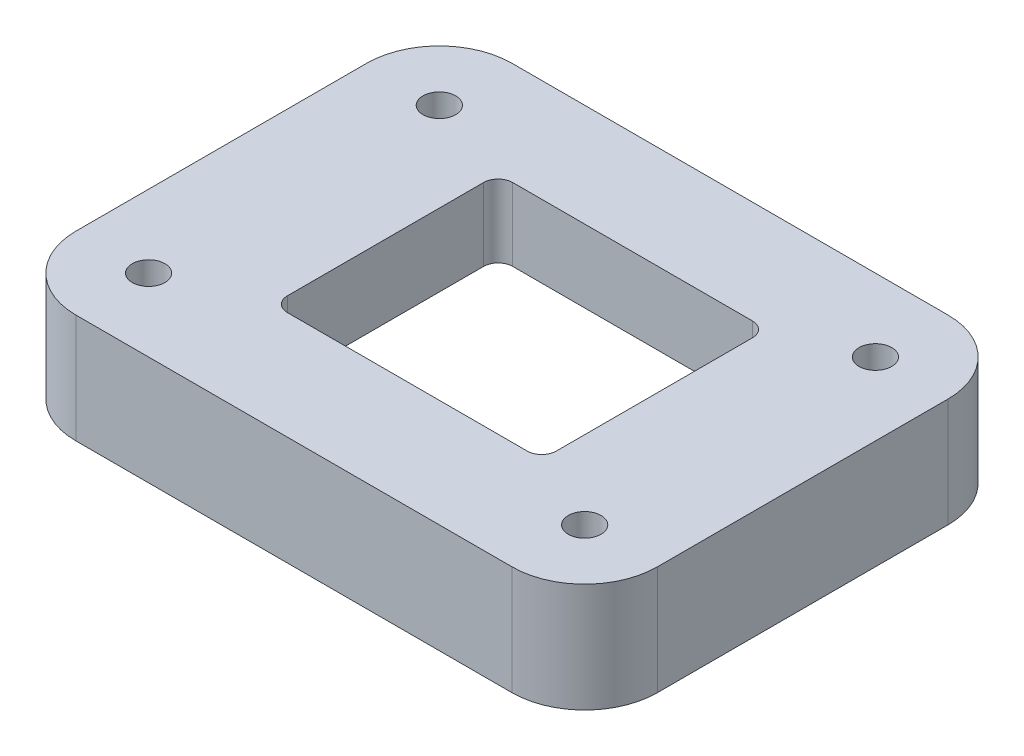
from build123d import *

# Parameters (mm, degrees)
ESQUISSE1_R             = 2.25
BOSS_EXTRU_1_DEPTH      = 15
ENL_V_MAT_EXTRU_1_DEPTH = 5


with BuildPart() as part:
    # Esquisse1 → Boss.-Extru.1 (new body)
    with BuildSketch(Plane(origin=(0, 0, 0), x_dir=(1, 0, 0), z_dir=(0, 1, 0))):
        with BuildLine():
            Line((10, 0), (70, 0))
            ThreePointArc((70, 0), (77.071067812, -2.928932188), (80, -10))
            Line((80, -10), (80, -50))
            ThreePointArc((80, -50), (77.071067812, -57.071067812), (70, -60))
            Line((70, -60), (10, -60))
            ThreePointArc((10, -60), (2.928932188, -57.071067812), (0, -50))
            Line((0, -50), (0, -10))
            ThreePointArc((0, -10), (2.928932188, -2.928932188), (10, 0))
        make_face()
        with Locations(Location((10, -10, 0), (0, 0, 270))):
            Circle(ESQUISSE1_R, mode=Mode.SUBTRACT)
        with Locations(Location((70, -10, 0), (0, 0, 270))):
            Circle(ESQUISSE1_R, mode=Mode.SUBTRACT)
        with Locations(Location((10, -50, 0), (0, 0, 270))):
            Circle(ESQUISSE1_R, mode=Mode.SUBTRACT)
        with Locations(Location((70, -50, 0), (0, 0, 270))):
            Circle(ESQUISSE1_R, mode=Mode.SUBTRACT)
        with BuildLine():
            Line((24.253765099, -14.157246889), (57.253765099, -14.157246889))
            ThreePointArc((57.253765099, -14.157246889), (58.667978662, -14.743033326), (59.253765099, -16.157246889))
            Line((59.253765099, -16.157246889), (59.253765099, -43.157246889))
            ThreePointArc((59.253765099, -43.157246889), (58.667978662, -44.571460451), (57.253765099, -45.157246889))
            Line((57.253765099, -45.157246889), (24.253765099, -45.157246889))
            ThreePointArc((24.253765099, -45.157246889), (22.839551537, -44.571460451), (22.253765099, -43.157246889))
            Line((22.253765099, -43.157246889), (22.253765099, -16.157246889))
            ThreePointArc((22.253765099, -16.157246889), (22.839551537, -14.743033326), (24.253765099, -14.157246889))
        make_face(mode=Mode.SUBTRACT)
    extrude(amount=BOSS_EXTRU_1_DEPTH)

    # Esquisse2 → Enlèv. mat.-Extru.1 (cut)
    with BuildSketch(Plane.XZ):
        with BuildLine():
            Line((8, 57), (72, 57))
            ThreePointArc((72, 57), (75.535533906, 55.535533906), (77, 52))
            Line((77, 52), (77, 8))
            ThreePointArc((77, 8), (75.535533906, 4.464466094), (72, 3))
            Line((72, 3), (8, 3))
            ThreePointArc((8, 3), (4.464466094, 4.464466094), (3, 8))
            Line((3, 8), (3, 52))
            ThreePointArc((3, 52), (4.464466094, 55.535533906), (8, 57))
        make_face()
    extrude(amount=-ENL_V_MAT_EXTRU_1_DEPTH, mode=Mode.SUBTRACT)


solid = part.part
